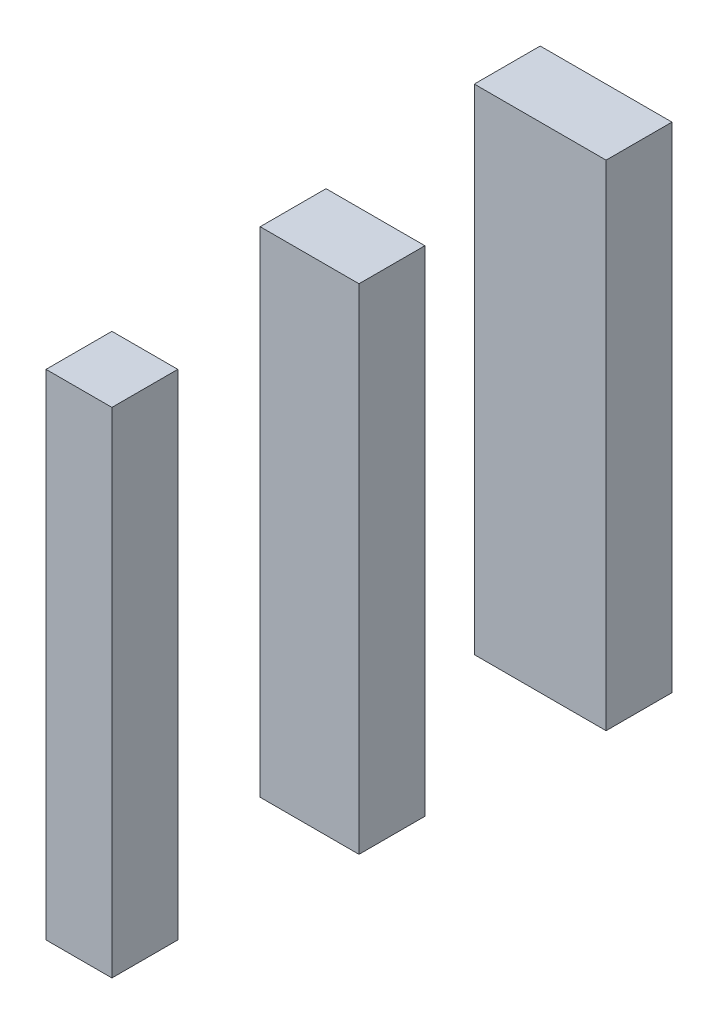
from build123d import *

# Parameters (mm, degrees)
SKETCH2_W             = 4
SKETCH2_H             = 4
BOSS_EXTRUDE1_DEPTH   = 30
SKETCH2_W_2           = 6
BOSS_EXTRUDE1_2_DEPTH = 30
SKETCH2_W_3           = 8
BOSS_EXTRUDE1_3_DEPTH = 30


with BuildPart() as part:
    # Sketch2 → Boss-Extrude1 (new body)
    with BuildSketch(Plane(origin=(0, 1, 0), x_dir=(1, 0, 0), z_dir=(0, 1, 0))):
        with Locations((0, -14)):
            Rectangle(SKETCH2_W, SKETCH2_H)
    extrude(amount=BOSS_EXTRUDE1_DEPTH)


with BuildPart() as body_2:
    # Sketch2 → Boss-Extrude1 2 (new body)
    with BuildSketch(Plane(origin=(0, 1, 0), x_dir=(1, 0, 0), z_dir=(0, 1, 0))):
        Rectangle(SKETCH2_W_2, SKETCH2_H)
    extrude(amount=BOSS_EXTRUDE1_2_DEPTH)


with BuildPart() as body_3:
    # Sketch2 → Boss-Extrude1 3 (new body)
    with BuildSketch(Plane(origin=(0, 1, 0), x_dir=(1, 0, 0), z_dir=(0, 1, 0))):
        with Locations((0, 14)):
            Rectangle(SKETCH2_W_3, SKETCH2_H)
    extrude(amount=BOSS_EXTRUDE1_3_DEPTH)


solid = Compound([part.part, body_2.part, body_3.part])
